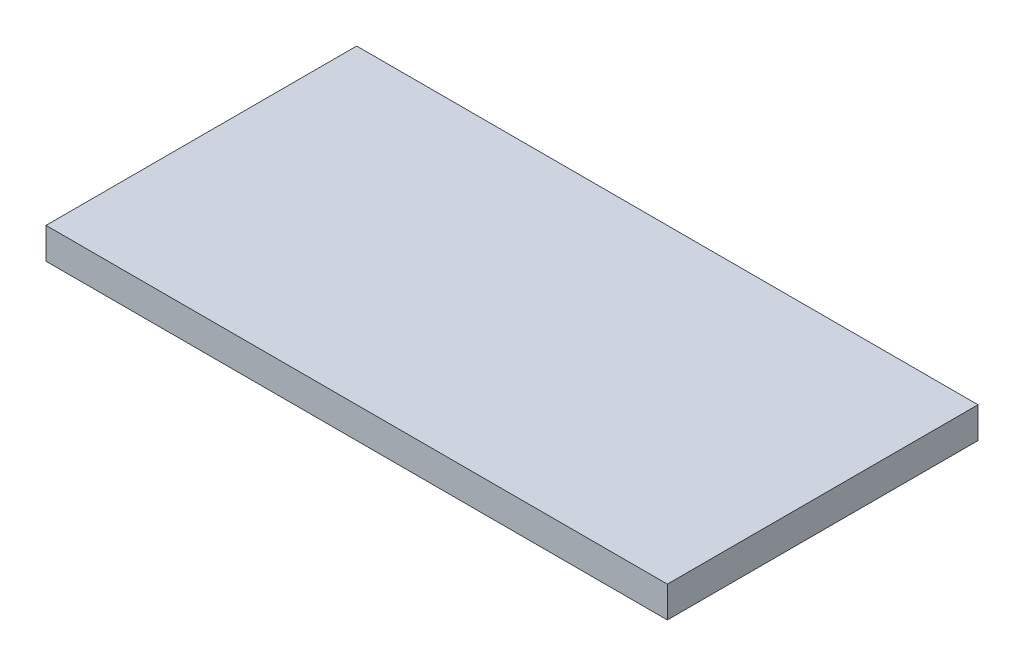
from build123d import *

# Parameters (mm, degrees)
OVEN_SICAK_DOLAP_ISITICI_100W_1_START = -300
SKETCH1_W                             = 200
SKETCH1_H                             = 10
OVEN_SICAK_DOLAP_ISITICI_100W_1_DEPTH = 100


with BuildPart() as part:
    # Sketch1 → OVEN_sicak_dolap_isitici_100W_1 (new body)
    with BuildSketch(Plane.XY.offset(OVEN_SICAK_DOLAP_ISITICI_100W_1_START)):
        with Locations((300, 867)):
            Rectangle(SKETCH1_W, SKETCH1_H)
    extrude(amount=-OVEN_SICAK_DOLAP_ISITICI_100W_1_DEPTH)


solid = part.part
